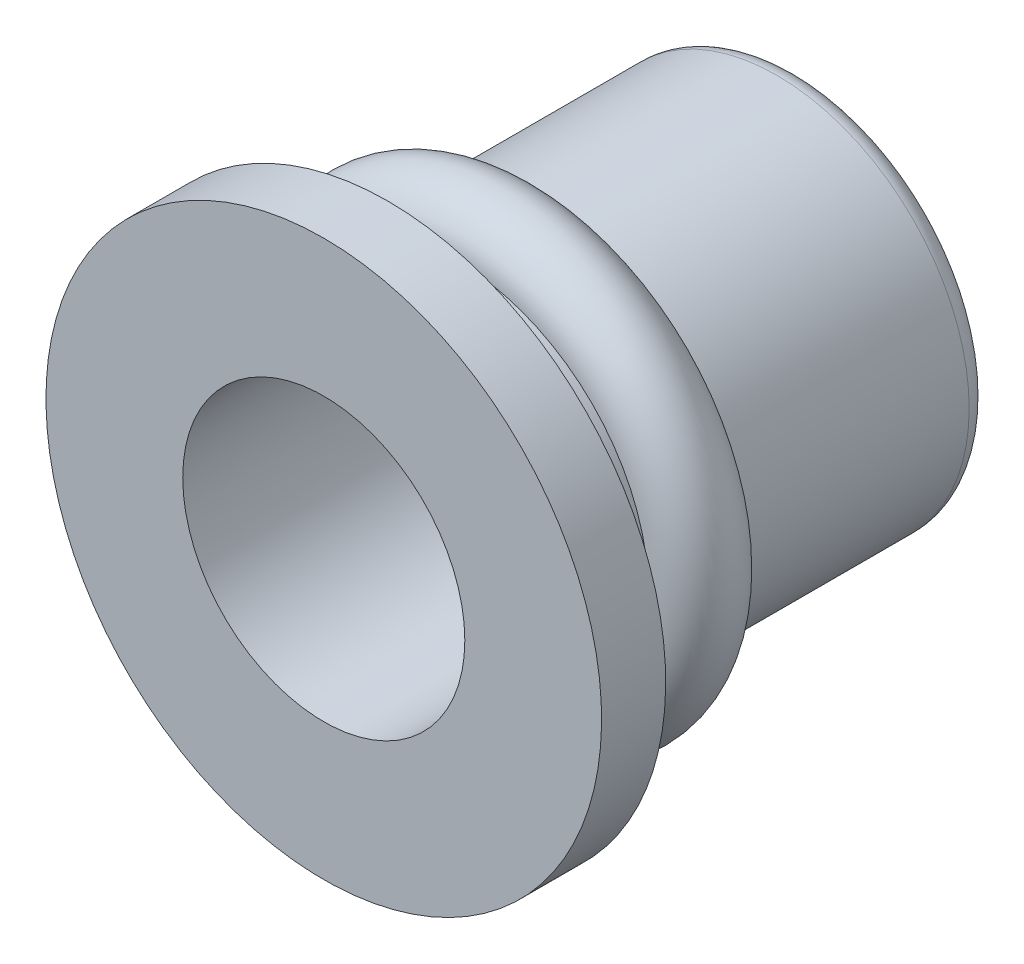
from build123d import *

# Parameters (mm, degrees)
FURO_COM_FOLGA_DE_M61_D = 6.6


with BuildPart() as part:
    # Esboço1 → Revolução1 (revolve)
    with BuildSketch(Plane(origin=(0, 0, 0), x_dir=(0, 0, -1), z_dir=(1, 0, 0))):
        with BuildLine():
            Line((0, 0), (0, 6.5))
            Line((0, 6.5), (1.5, 6.5))
            Line((1.5, 6.5), (1.5, 4.5))
            Line((1.5, 4.5), (3.1, 4.5))
            ThreePointArc((3.1, 4.5), (4.1, 5.5), (5.1, 4.5))
            Line((5.1, 4.5), (10.6, 4.5))
            ThreePointArc((10.6, 4.5), (10.953553391, 4.353553391), (11.1, 4))
            Line((11.1, 4), (11.1, 0))
            Line((11.1, 0), (0, 0))
        make_face()
    revolve(axis=Axis((0, 0, -11.1), (0, 0, 1)))

    # Furo com folga de M61 (through all)
    with Locations(Plane.XY):
        with Locations((0, 0)):
            Hole(FURO_COM_FOLGA_DE_M61_D / 2)


solid = part.part
